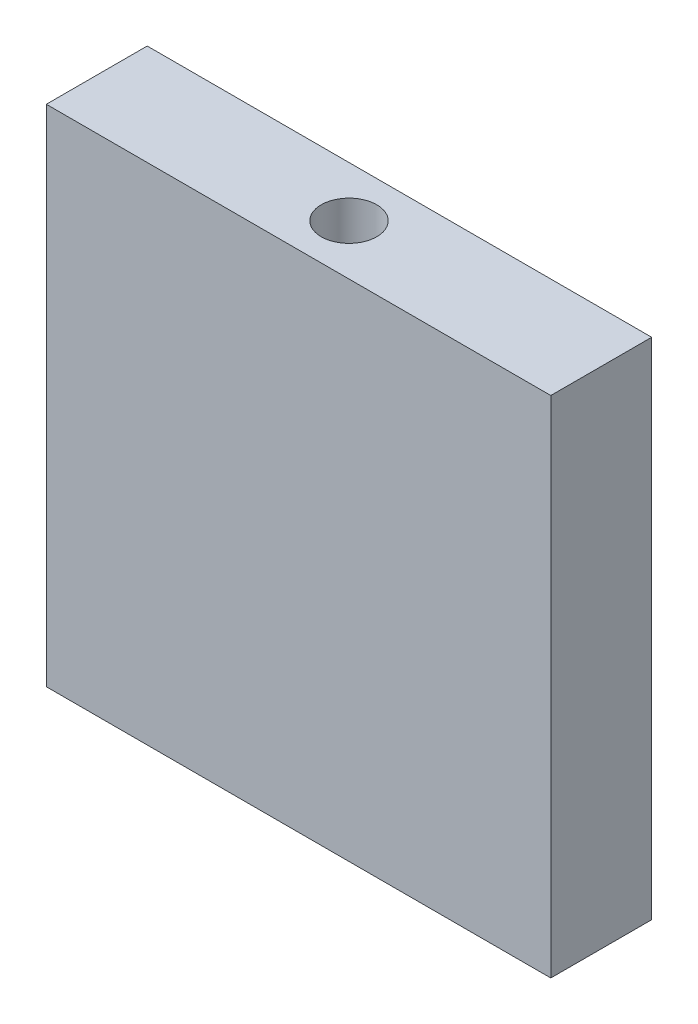
from build123d import *

# Parameters (mm, degrees)
SKETCH1_W           = 100
SKETCH1_H           = 100
BOSS_EXTRUDE1_DEPTH = 20
SKETCH2_R           = 5.5
CUT_EXTRUDE1_DEPTH  = 10


with BuildPart() as part:
    # Sketch1 → Boss-Extrude1 (new body)
    with BuildSketch(Plane.XY):
        with Locations((-68.263473054, 50)):
            Rectangle(SKETCH1_W, SKETCH1_H)
    extrude(amount=BOSS_EXTRUDE1_DEPTH)

    # Sketch2 → Cut-Extrude1 (cut)
    with BuildSketch(Plane(origin=(0, 100, 0), x_dir=(1, 0, 0), z_dir=(0, 1, 0))):
        with Locations(Location((-68.263473054, -10, 0), (0, 0, 270))):
            Circle(SKETCH2_R)
    extrude(amount=-CUT_EXTRUDE1_DEPTH, mode=Mode.SUBTRACT)


solid = part.part
